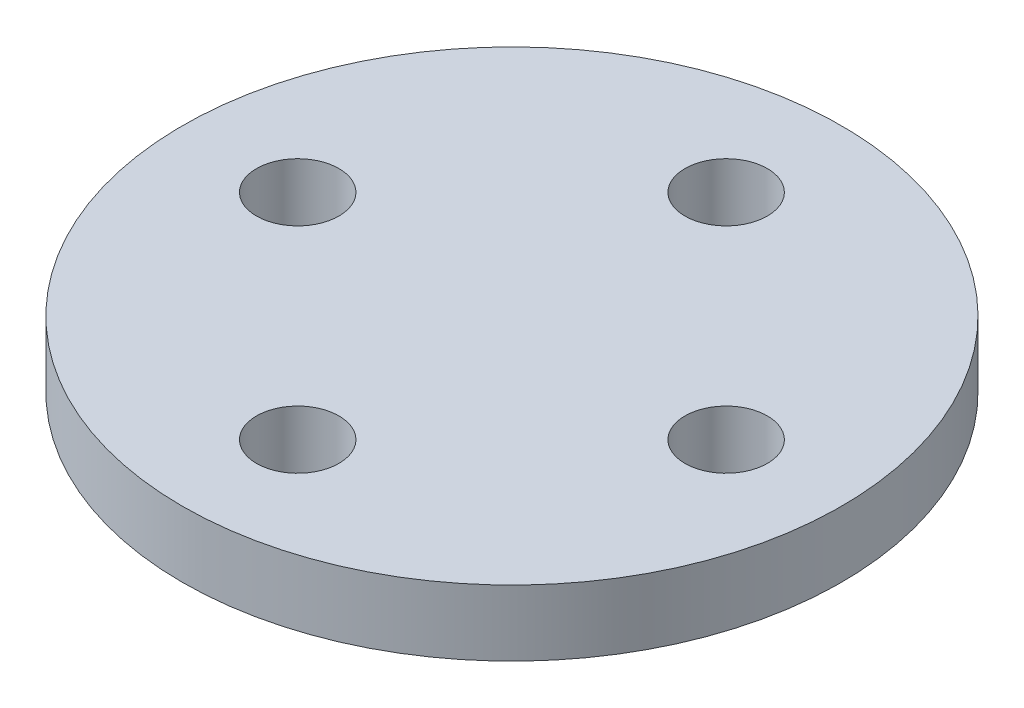
from build123d import *

# Parameters (mm, degrees)
SKETCH_1_R          = 10
SKETCH_1_R_2        = 1.25
EXTRUDE_1_DEPTH     = 2
SKETCH_2_R          = 4.5
EXTRUDE_2_DEPTH     = 2
SKETCH_3_R          = 2.5
CUT_EXTRUDE_1_DEPTH = 2


with BuildPart() as part:
    # 草图1 → 凸台-拉伸1 (new body)
    with BuildSketch(Plane(origin=(0, 0, 0), x_dir=(1, 0, 0), z_dir=(0, 1, 0))):
        with Locations(Location((0, 0, 0), (0, 0, 270))):
            Circle(SKETCH_1_R)
        with Locations(Location((0, 6.5, 0), (0, 0, 270))):
            Circle(SKETCH_1_R_2, mode=Mode.SUBTRACT)
        with Locations(Location((6.5, 0, 0), (0, 0, 270))):
            Circle(SKETCH_1_R_2, mode=Mode.SUBTRACT)
        with Locations(Location((0, -6.5, 0), (0, 0, 270))):
            Circle(SKETCH_1_R_2, mode=Mode.SUBTRACT)
        with Locations(Location((-6.5, 0, 0), (0, 0, 270))):
            Circle(SKETCH_1_R_2, mode=Mode.SUBTRACT)
    extrude(amount=EXTRUDE_1_DEPTH)

    # 草图2 → 凸台-拉伸2 (add)
    with BuildSketch(Plane.XZ):
        with Locations(Location((0, 0, 0), (0, 0, 270))):
            Circle(SKETCH_2_R)
    extrude(amount=EXTRUDE_2_DEPTH)

    # 草图3 → 切除-拉伸1 (cut)
    with BuildSketch(Plane.XZ.offset(2)):
        with Locations(Location((0, 0, 0), (0, 0, 270))):
            Circle(SKETCH_3_R)
    extrude(amount=-CUT_EXTRUDE_1_DEPTH, mode=Mode.SUBTRACT)


solid = part.part
